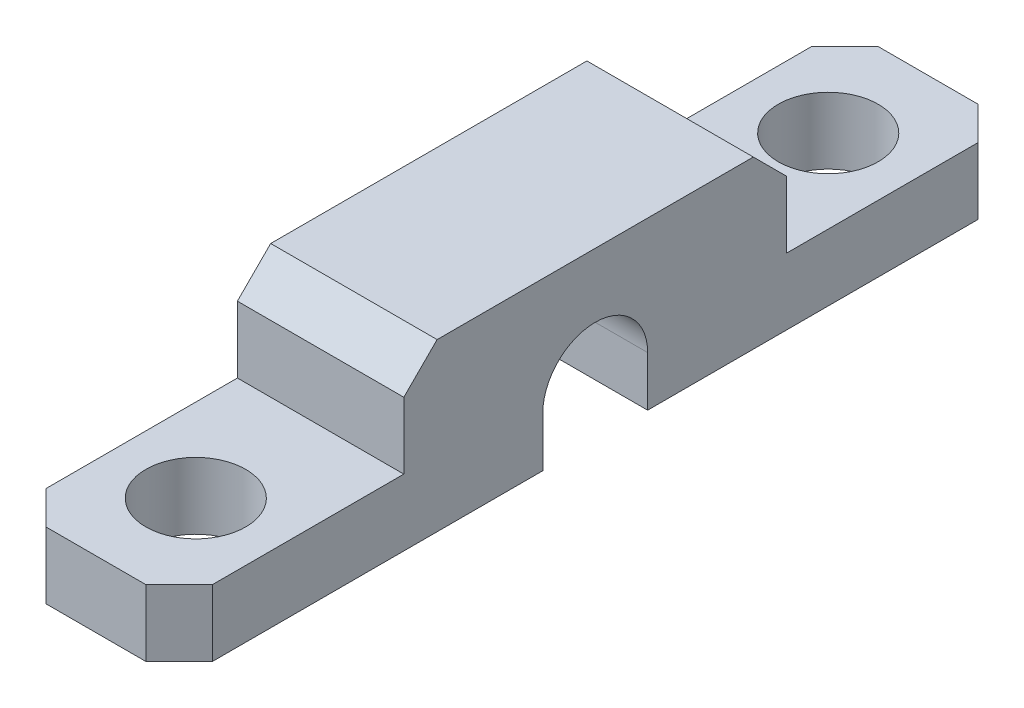
from build123d import *

# Parameters (mm, degrees)
SKETCH1_W           = 50
SKETCH1_H           = 10
BOSS_EXTRUDE1_DEPTH = 10
SKETCH3_W           = 10
SKETCH3_H           = 13.5
CUT_EXTRUDE1_DEPTH  = 6
SKETCH4_R           = 3
CUT_EXTRUDE2_DEPTH  = 6
SKETCH5_R           = 3.15
SKETCH5_W           = 6.3
SKETCH5_H           = 7.480912946
CUT_EXTRUDE3_DEPTH  = 28.386127875
CHAMFER1_SIZE       = 2


with BuildPart() as part:
    # Sketch1 → Boss-Extrude1 (new body)
    with BuildSketch(Plane(origin=(0, 0, 0), x_dir=(0, 0, -1), z_dir=(1, 0, 0))):
        Rectangle(SKETCH1_W, SKETCH1_H)
    extrude(amount=BOSS_EXTRUDE1_DEPTH)

    # Sketch3 → Cut-Extrude1 (cut)
    with BuildSketch(Plane(origin=(0, 5, 0), x_dir=(1, 0, 0), z_dir=(0, 1, 0))):
        with Locations((5, -18.25)):
            Rectangle(SKETCH3_W, SKETCH3_H)
        with Locations((5, 18.25)):
            Rectangle(SKETCH3_W, SKETCH3_H)
    extrude(amount=-CUT_EXTRUDE1_DEPTH, mode=Mode.SUBTRACT)

    # Sketch4 → Cut-Extrude2 (cut)
    with BuildSketch(Plane(origin=(0, -1, 0), x_dir=(1, 0, 0), z_dir=(0, 1, 0))):
        with Locations(Location((5, 19, 0), (0, 0, 270))):
            Circle(SKETCH4_R)
        with Locations(Location((5, -19, 0), (0, 0, 270))):
            Circle(SKETCH4_R)
    extrude(amount=-CUT_EXTRUDE2_DEPTH, mode=Mode.SUBTRACT)

    # Sketch5 → Cut-Extrude3 (cut, through all)
    with BuildSketch(Plane(origin=(10, 0, 0), x_dir=(0, 0, -1), z_dir=(1, 0, 0))):
        with Locations((0, -2)):
            Circle(SKETCH5_R)
        with Locations((0, -5.740456473)):
            Rectangle(SKETCH5_W, SKETCH5_H)
    extrude(amount=-CUT_EXTRUDE3_DEPTH, mode=Mode.SUBTRACT)

    # Chamfer1
    chamfer1_edges = [part.edges().sort_by_distance(p)[0] for p in [
        (0, -3, 25),
        (10, -3, 25),
        (5, 5, 11.5),
        (5, 5, -11.5),
        (10, -3, -25),
        (0, -3, -25),
    ]]
    chamfer(chamfer1_edges, length=CHAMFER1_SIZE)


solid = part.part
